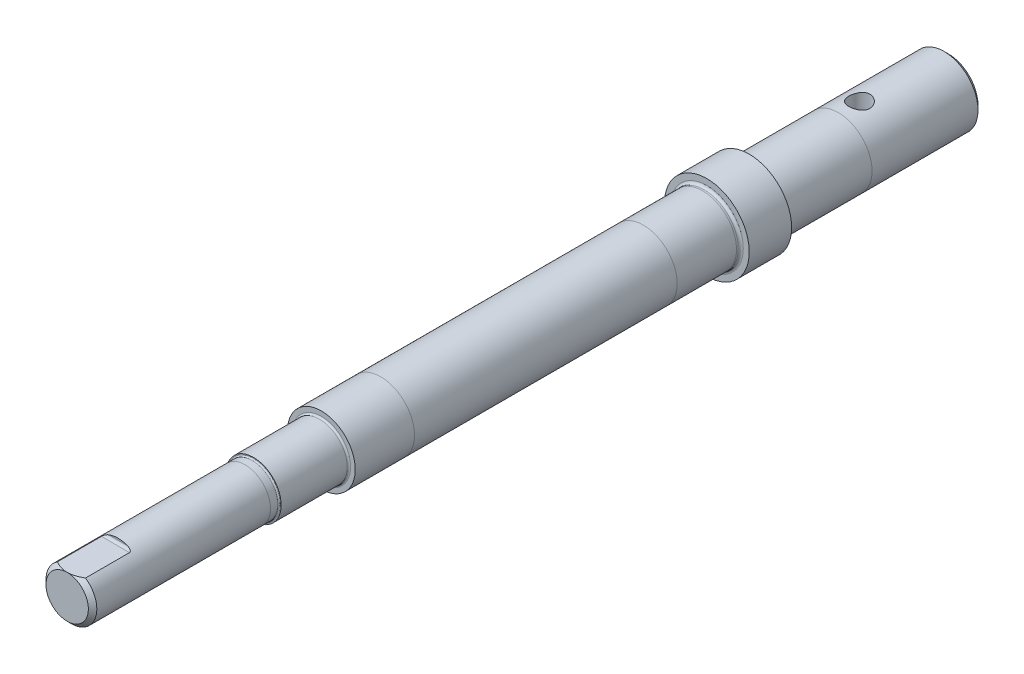
from build123d import *

# Parameters (mm, degrees)
CROQUIS1_R              = 4
SALIENTE_EXTRUIR1_DEPTH = 52
CROQUIS2_R              = 5
SALIENTE_EXTRUIR2_DEPTH = 5
CROQUIS3_R              = 4
CROQUIS3_R_2            = 3
CORTAR_EXTRUIR1_DEPTH   = 22
CROQUIS5_R              = 1.25
CORTAR_EXTRUIR2_DEPTH   = 54.009433123
CHAFL_N1_SIZE           = 0.5
CROQUIS6_W              = 6
CROQUIS6_H              = 6
CORTAR_EXTRUIR3_DEPTH   = 53.775467786
CROQUIS7_R              = 4
CROQUIS7_R_2            = 3.25
CORTAR_EXTRUIR4_DEPTH   = 8
REDONDEO2_R             = 0.15
REDONDEO3_R             = 0.2
REDONDEO1_R             = 0.3
REDONDEO4_R             = 0.3
REDONDEO5_R             = 0.3


with BuildPart() as part:
    # Croquis1 → Saliente-Extruir1 (new, symmetric)
    with BuildSketch(Plane.XY):
        with Locations(Location((0, 0, 0), (0, 0, 180))):
            Circle(CROQUIS1_R)
    extrude(amount=SALIENTE_EXTRUIR1_DEPTH, both=True)

    # Croquis2 → Saliente-Extruir2 (add)
    with BuildSketch(Plane.XY.offset(-28.5)):
        Circle(CROQUIS2_R)
    extrude(amount=SALIENTE_EXTRUIR2_DEPTH)

    # Croquis3 → Cortar-Extruir1 (cut)
    with BuildSketch(Plane.XY.offset(52)):
        with Locations(Location((0, 0, 0), (0, 0, 180))):
            Circle(CROQUIS3_R)
        Circle(CROQUIS3_R_2, mode=Mode.SUBTRACT)
    extrude(amount=-CORTAR_EXTRUIR1_DEPTH, mode=Mode.SUBTRACT)

    # Croquis5 → Cortar-Extruir2 (cut, through all)
    with BuildSketch(Plane(origin=(0, 4, 0), x_dir=(1, 0, 0), z_dir=(0, 1, 0))):
        with Locations(Location((0, 41.5, 0), (0, 0, 270))):
            Circle(CROQUIS5_R)
    extrude(amount=-CORTAR_EXTRUIR2_DEPTH, mode=Mode.SUBTRACT)

    # Chaflán1
    chafl_n1_edges = [part.edges().sort_by_distance(p)[0] for p in [
        (-3, 0, 52),
        (4, 0, -52),
    ]]
    chamfer(chafl_n1_edges, length=CHAFL_N1_SIZE)

    # Croquis6 → Cortar-Extruir3 (cut, through all)
    with BuildSketch(Plane(origin=(0, 2.5, 0), x_dir=(1, 0, 0), z_dir=(0, 1, 0))):
        with Locations((0, -49)):
            Rectangle(CROQUIS6_W, CROQUIS6_H)
    extrude(amount=CORTAR_EXTRUIR3_DEPTH, mode=Mode.SUBTRACT)

    # Croquis7 → Cortar-Extruir4 (cut)
    with BuildSketch(Plane.XY.offset(30)):
        with Locations(Location((0, 0, 0), (0, 0, 180))):
            Circle(CROQUIS7_R)
        Circle(CROQUIS7_R_2, mode=Mode.SUBTRACT)
    extrude(amount=-CORTAR_EXTRUIR4_DEPTH, mode=Mode.SUBTRACT)

    # Redondeo2
    redondeo2_edges = [part.edges().sort_by_distance(p)[0] for p in [
        (-3, 0, 30),
    ]]
    fillet(redondeo2_edges, radius=REDONDEO2_R)

    # Redondeo3
    redondeo3_edges = [part.edges().sort_by_distance(p)[0] for p in [
        (-3.25, 0, 22),
    ]]
    fillet(redondeo3_edges, radius=REDONDEO3_R)

    # Redondeo1
    redondeo1_edges = [part.edges().sort_by_distance(p)[0] for p in [
        (4, 0, -23.5),
    ]]
    fillet(redondeo1_edges, radius=REDONDEO1_R)

    # Redondeo4
    redondeo4_edges = [part.edges().sort_by_distance(p)[0] for p in [
        (4, 0, -28.5),
    ]]
    fillet(redondeo4_edges, radius=REDONDEO4_R)

    # Redondeo5
    redondeo5_edges = [part.edges().sort_by_distance(p)[0] for p in [
        (0, 2.5, 46),
    ]]
    fillet(redondeo5_edges, radius=REDONDEO5_R)


solid = part.part
